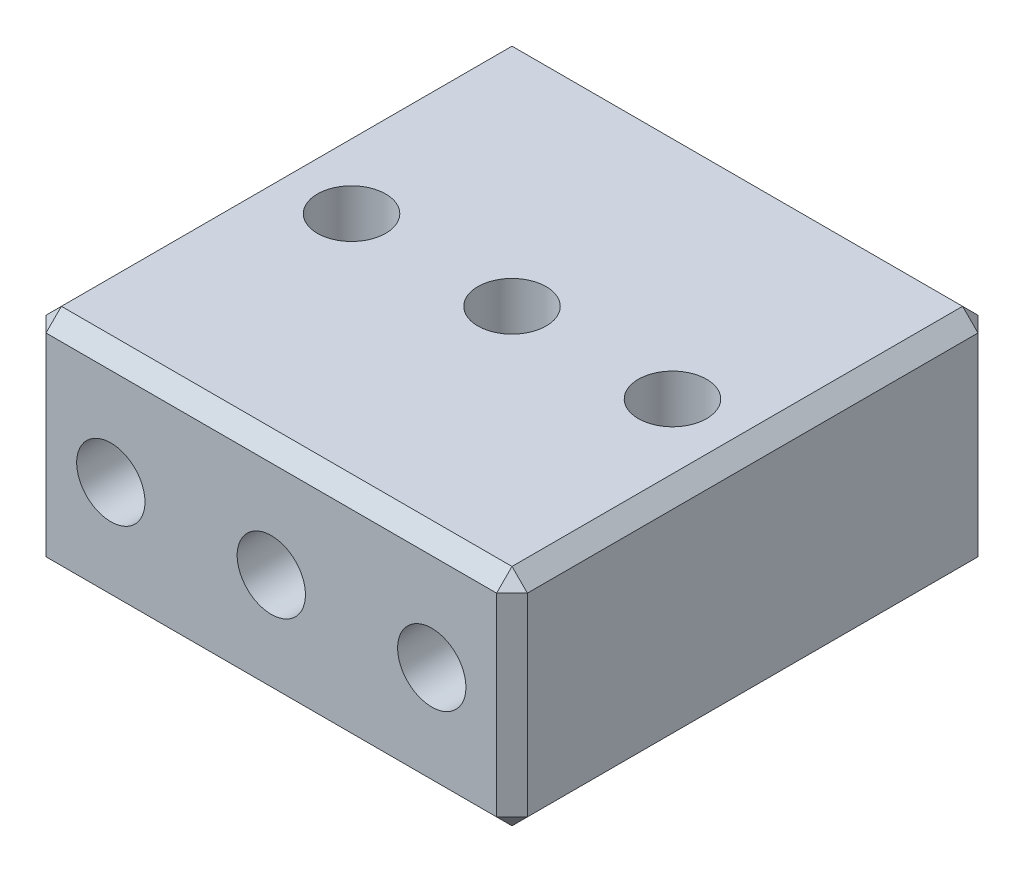
from build123d import *

# Parameters (mm, degrees)
SKETCH1_W               = 47.625
SKETCH1_H               = 22.225
BOSS_EXTRUDE1_DEPTH     = 23.8125
F_1_4_CLEARANCE_HOLE1_D = 6.7564
F_1_4_CLEARANCE_HOLE2_D = 6.7564
CHAMFER1_SIZE           = 1.524


with BuildPart() as part:
    # Sketch1 → Boss-Extrude1 (new, symmetric)
    with BuildSketch(Plane(origin=(0, 0, 0), x_dir=(0, 0, -1), z_dir=(1, 0, 0))):
        Rectangle(SKETCH1_W, SKETCH1_H)
    extrude(amount=BOSS_EXTRUDE1_DEPTH, both=True)

    # 1/4 Clearance Hole1 (through all)
    with Locations(Plane.XY.offset(23.8125)):
        with Locations((0, 0), (-15.875, 0), (15.875, 0)):
            Hole(F_1_4_CLEARANCE_HOLE1_D / 2)

    # 1/4 Clearance Hole2 (through all)
    with Locations(Plane(origin=(0, 11.1125, 0), x_dir=(1, 0, 0), z_dir=(0, 1, 0))):
        with Locations((-15.875, 0), (15.875, 0), (0, 0)):
            Hole(F_1_4_CLEARANCE_HOLE2_D / 2)

    # Chamfer1
    chamfer1_edges = [part.edges().sort_by_distance(p)[0] for p in [
        (23.8125, 0, -23.8125),
        (23.8125, 11.1125, 0),
        (23.8125, 0, 23.8125),
        (-23.8125, 11.1125, 0),
        (-23.8125, 0, -23.8125),
        (-23.8125, -11.1125, 0),
        (-23.8125, 0, 23.8125),
        (0, 11.1125, 23.8125),
        (0, 11.1125, -23.8125),
        (0, -11.1125, -23.8125),
        (0, -11.1125, 23.8125),
        (23.8125, -11.1125, 0),
    ]]
    chamfer(chamfer1_edges, length=CHAMFER1_SIZE)


solid = part.part
